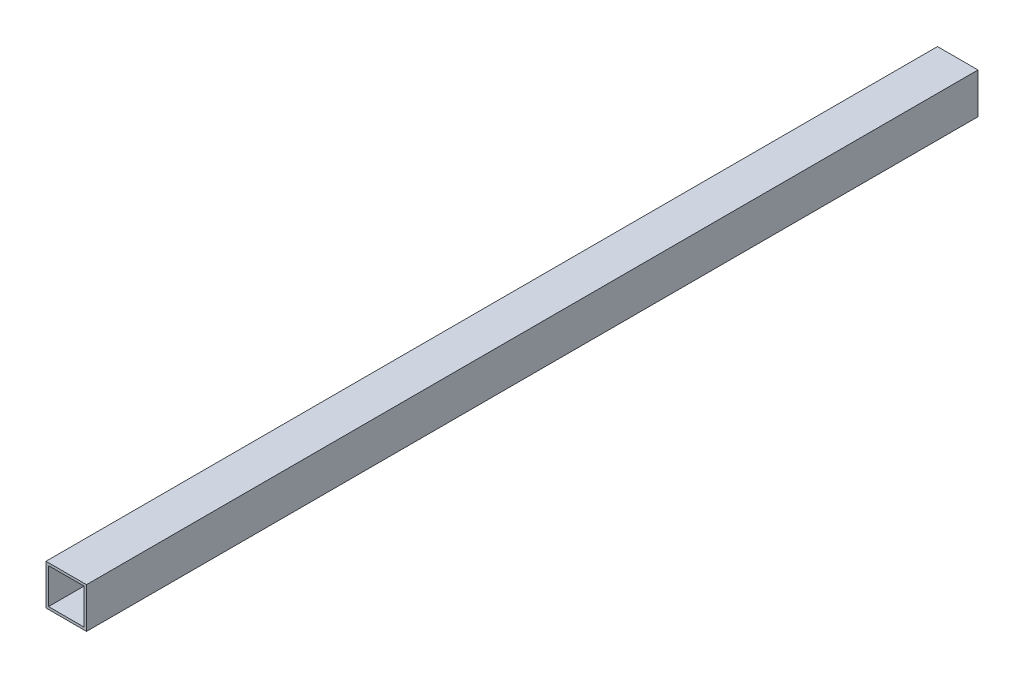
from build123d import *

# Parameters (mm, degrees)
BOSS_EXTRUDE1_DEPTH      = 914.4
BOSS_EXTRUDE1_DEPTH_BACK = 914.4
SKETCH3_W                = 25.4
SKETCH3_H                = 25.4
SKETCH3_W_2              = 22.225
SKETCH3_H_2              = 22.225
SKETCH5_W                = 72.516391498
SKETCH5_H                = 62.595227754
CUT_EXTRUDE1_DEPTH       = 1270


with BuildPart() as part:
    # Sketch3 → Boss-Extrude1 (new, two sides: drawn at the far end of the back side and taken through both)
    with BuildSketch(Plane.XY.offset(-BOSS_EXTRUDE1_DEPTH_BACK)):
        Rectangle(SKETCH3_W, SKETCH3_H)
        Rectangle(SKETCH3_W_2, SKETCH3_H_2, mode=Mode.SUBTRACT)
    extrude(amount=BOSS_EXTRUDE1_DEPTH + BOSS_EXTRUDE1_DEPTH_BACK)

    # Sketch5 → Cut-Extrude1 (cut)
    with BuildSketch(Plane.XY.offset(914.4)):
        Rectangle(SKETCH5_W, SKETCH5_H)
    extrude(amount=-CUT_EXTRUDE1_DEPTH, mode=Mode.SUBTRACT)


solid = part.part
